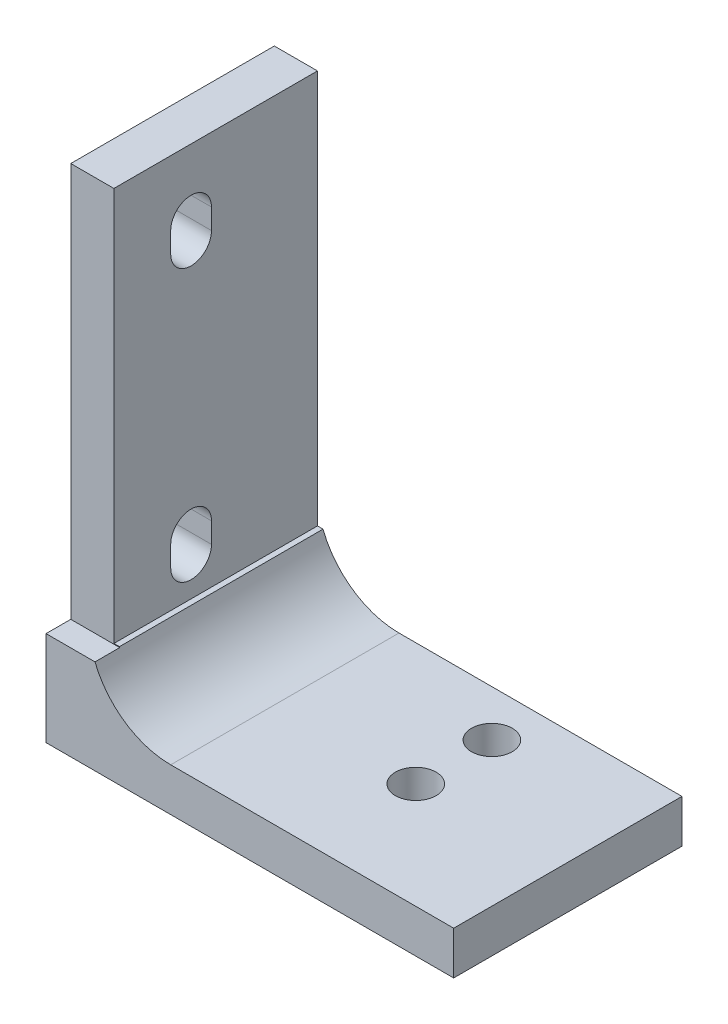
from build123d import *

# Parameters (mm, degrees)
BOSS_EXTRUDE1_DEPTH      = 8.4
BOSS_EXTRUDE1_DEPTH_BACK = 8.4
FILLET1_R                = 6
CUT_EXTRUDE2_DEPTH       = 10
CUT_EXTRUDE1_DEPTH       = 10
CUT_EXTRUDE1_DEPTH_BACK  = 10
SKETCH3_W                = 1
SKETCH3_H                = 7.737404144
SKETCH5_R                = 1.5
CUT_EXTRUDE3_DEPTH       = 7
SKETCH6_W                = 1.82
SKETCH6_H                = 29.05
CUT_EXTRUDE4_DEPTH       = 7


with BuildPart() as part:
    # Sketch1 → Boss-Extrude1 (new, two sides: drawn at the far end of the back side and taken through both)
    with BuildSketch(Plane.XY.offset(-BOSS_EXTRUDE1_DEPTH_BACK)):
        Polygon((0, 0), (0, 36), (3.175, 36), (3.175, 3.175), (30, 3.175), (30, 0), align=None)
    extrude(amount=BOSS_EXTRUDE1_DEPTH + BOSS_EXTRUDE1_DEPTH_BACK)

    # Fillet1
    fillet1_edges = [part.edges().sort_by_distance(p)[0] for p in [
        (3.175, 3.175, 0),
    ]]
    fillet(fillet1_edges, radius=FILLET1_R)

    # Sketch4 → Cut-Extrude2 (cut)
    with BuildSketch(Plane.ZY):
        with BuildLine():
            Line((2.4, 31.225), (2.4, 29.725))
            ThreePointArc((2.4, 29.725), (0.9, 28.225), (-0.6, 29.725))
            Line((-0.6, 29.725), (-0.6, 31.225))
            ThreePointArc((-0.6, 31.225), (0.9, 32.725), (2.4, 31.225))
        make_face()
        with BuildLine():
            Line((-0.6, 9.725), (-0.6, 11.225))
            ThreePointArc((-0.6, 11.225), (0.9, 12.725), (2.4, 11.225))
            Line((2.4, 11.225), (2.4, 9.725))
            ThreePointArc((2.4, 9.725), (0.9, 8.225), (-0.6, 9.725))
        make_face()
    extrude(amount=-CUT_EXTRUDE2_DEPTH, mode=Mode.SUBTRACT)

    # Sketch3 → Cut-Extrude1 (cut, two sides: drawn at the far end of the back side and taken through both)
    with BuildSketch(Plane.XY.offset(-CUT_EXTRUDE1_DEPTH_BACK)):
        with Locations((3.675, 10.868702072)):
            Rectangle(SKETCH3_W, SKETCH3_H)
    extrude(amount=CUT_EXTRUDE1_DEPTH + CUT_EXTRUDE1_DEPTH_BACK, mode=Mode.SUBTRACT)

    # Sketch5 → Cut-Extrude3 (cut)
    with BuildSketch(Plane.XZ):
        with Locations((19.41, 0.6)):
            Circle(SKETCH5_R)
        with Locations((19.41, -5)):
            Circle(SKETCH5_R)
    extrude(amount=-CUT_EXTRUDE3_DEPTH, mode=Mode.SUBTRACT)

    # Sketch6 → Cut-Extrude4 (cut)
    with BuildSketch(Plane.ZY):
        with Locations((7.49, 21.475)):
            Rectangle(SKETCH6_W, SKETCH6_H)
    extrude(amount=-CUT_EXTRUDE4_DEPTH, mode=Mode.SUBTRACT)


solid = part.part
